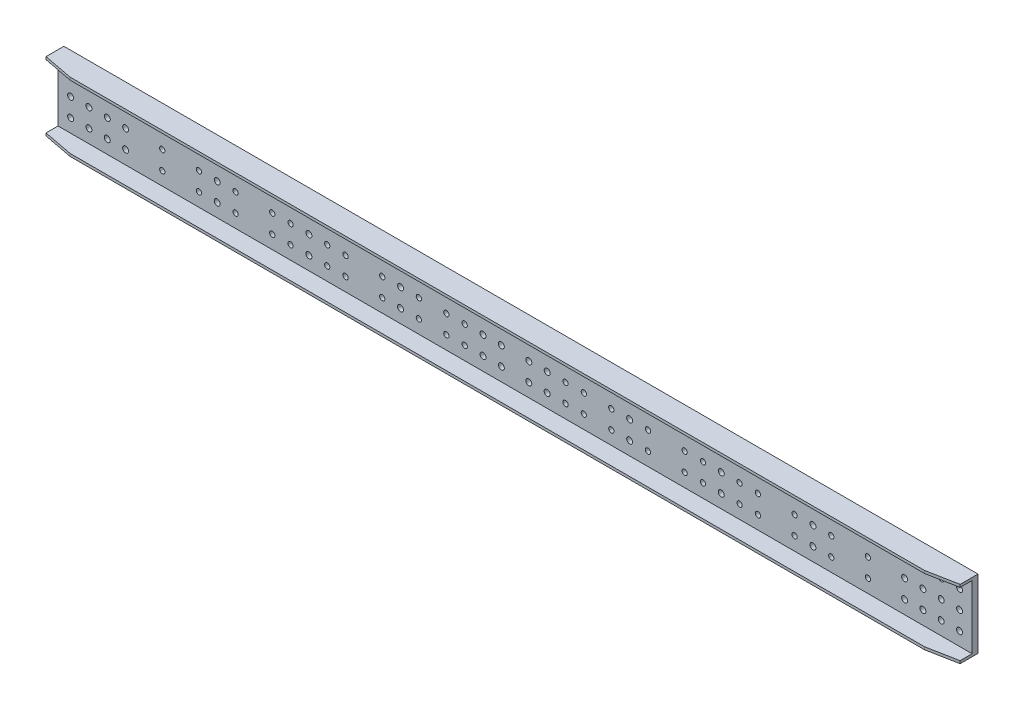
from build123d import *

# Parameters (mm, degrees)
SKETCH_1_W          = 3990
SKETCH_1_H          = 300
SKETCH_1_R          = 13
SKETCH_1_R_2        = 11.5
EXTRUDE_1595_DEPTH  = 25.5
SKETCH_2_W          = 3990
SKETCH_2_H          = 11.5
EXTRUDE_1_DEPTH     = 77.5
SKETCH_3_W          = 70
SKETCH_3_H          = 230
EXTRUDE_2_DEPTH     = 16
SKETCH_4_R          = 13
CUT_EXTRUDE_1_DEPTH = 2003.131676489
CUT_EXTRUDE_2_DEPTH = 2021.057919962


with BuildPart() as part:
    # 草图1 → Extrude 1595 (new body)
    with BuildSketch(Plane.XY):
        Rectangle(SKETCH_1_W, SKETCH_1_H)
        with Locations((1940, 80)):
            Circle(SKETCH_1_R, mode=Mode.SUBTRACT)
        with Locations((1860, 80)):
            Circle(SKETCH_1_R, mode=Mode.SUBTRACT)
        with Locations((1780, 80)):
            Circle(SKETCH_1_R, mode=Mode.SUBTRACT)
        with Locations((1700, 80)):
            Circle(SKETCH_1_R, mode=Mode.SUBTRACT)
        with Locations((1540, 80)):
            Circle(SKETCH_1_R_2, mode=Mode.SUBTRACT)
        with Locations((1380, 80)):
            Circle(SKETCH_1_R_2, mode=Mode.SUBTRACT)
        with Locations((1220, 80)):
            Circle(SKETCH_1_R_2, mode=Mode.SUBTRACT)
        with Locations((1060, 80)):
            Circle(SKETCH_1_R_2, mode=Mode.SUBTRACT)
        with Locations((980, 80)):
            Circle(SKETCH_1_R_2, mode=Mode.SUBTRACT)
        with Locations((820, 80)):
            Circle(SKETCH_1_R_2, mode=Mode.SUBTRACT)
        with Locations((740, 80)):
            Circle(SKETCH_1_R_2, mode=Mode.SUBTRACT)
        with Locations((580, 80)):
            Circle(SKETCH_1_R_2, mode=Mode.SUBTRACT)
        with Locations((980, 0)):
            Circle(SKETCH_1_R_2, mode=Mode.SUBTRACT)
        with Locations((1060, 0)):
            Circle(SKETCH_1_R_2, mode=Mode.SUBTRACT)
        with Locations((820, 0)):
            Circle(SKETCH_1_R_2, mode=Mode.SUBTRACT)
        with Locations((740, 0)):
            Circle(SKETCH_1_R_2, mode=Mode.SUBTRACT)
        with Locations((580, 0)):
            Circle(SKETCH_1_R_2, mode=Mode.SUBTRACT)
        with Locations((1220, 0)):
            Circle(SKETCH_1_R_2, mode=Mode.SUBTRACT)
        with Locations((1380, 0)):
            Circle(SKETCH_1_R_2, mode=Mode.SUBTRACT)
        with Locations((1540, 0)):
            Circle(SKETCH_1_R_2, mode=Mode.SUBTRACT)
        with Locations((1700, 0)):
            Circle(SKETCH_1_R, mode=Mode.SUBTRACT)
        with Locations((1780, 0)):
            Circle(SKETCH_1_R, mode=Mode.SUBTRACT)
        with Locations((1860, 0)):
            Circle(SKETCH_1_R, mode=Mode.SUBTRACT)
        with Locations((1940, 0)):
            Circle(SKETCH_1_R, mode=Mode.SUBTRACT)
        with Locations((420, 80)):
            Circle(SKETCH_1_R_2, mode=Mode.SUBTRACT)
        with Locations((420, 0)):
            Circle(SKETCH_1_R_2, mode=Mode.SUBTRACT)
        with Locations((300, 0)):
            Circle(SKETCH_1_R_2, mode=Mode.SUBTRACT)
        with Locations((300, 80)):
            Circle(SKETCH_1_R_2, mode=Mode.SUBTRACT)
        with Locations((220, 80)):
            Circle(SKETCH_1_R_2, mode=Mode.SUBTRACT)
        with Locations((220, 0)):
            Circle(SKETCH_1_R_2, mode=Mode.SUBTRACT)
        with Locations((140, 0)):
            Circle(SKETCH_1_R, mode=Mode.SUBTRACT)
        with Locations((140, 80)):
            Circle(SKETCH_1_R, mode=Mode.SUBTRACT)
        with Locations((60, 80)):
            Circle(SKETCH_1_R, mode=Mode.SUBTRACT)
        with Locations((60, 0)):
            Circle(SKETCH_1_R, mode=Mode.SUBTRACT)
        with Locations(Location((1700, -80, 0), (0, 0, 180))):
            Circle(SKETCH_1_R, mode=Mode.SUBTRACT)
        with Locations(Location((1780, -80, 0), (0, 0, 180))):
            Circle(SKETCH_1_R, mode=Mode.SUBTRACT)
        with Locations(Location((1860, -80, 0), (0, 0, 180))):
            Circle(SKETCH_1_R, mode=Mode.SUBTRACT)
        with Locations(Location((1940, -80, 0), (0, 0, 180))):
            Circle(SKETCH_1_R, mode=Mode.SUBTRACT)
        with Locations(Location((580, -80, 0), (0, 0, 180))):
            Circle(SKETCH_1_R_2, mode=Mode.SUBTRACT)
        with Locations(Location((740, -80, 0), (0, 0, 180))):
            Circle(SKETCH_1_R_2, mode=Mode.SUBTRACT)
        with Locations(Location((820, -80, 0), (0, 0, 180))):
            Circle(SKETCH_1_R_2, mode=Mode.SUBTRACT)
        with Locations(Location((980, -80, 0), (0, 0, 180))):
            Circle(SKETCH_1_R_2, mode=Mode.SUBTRACT)
        with Locations(Location((1060, -80, 0), (0, 0, 180))):
            Circle(SKETCH_1_R_2, mode=Mode.SUBTRACT)
        with Locations(Location((1220, -80, 0), (0, 0, 180))):
            Circle(SKETCH_1_R_2, mode=Mode.SUBTRACT)
        with Locations(Location((1380, -80, 0), (0, 0, 180))):
            Circle(SKETCH_1_R_2, mode=Mode.SUBTRACT)
        with Locations(Location((1540, -80, 0), (0, 0, 180))):
            Circle(SKETCH_1_R_2, mode=Mode.SUBTRACT)
        with Locations(Location((220, -80, 0), (0, 0, 180))):
            Circle(SKETCH_1_R_2, mode=Mode.SUBTRACT)
        with Locations(Location((300, -80, 0), (0, 0, 180))):
            Circle(SKETCH_1_R_2, mode=Mode.SUBTRACT)
        with Locations(Location((420, -80, 0), (0, 0, 180))):
            Circle(SKETCH_1_R_2, mode=Mode.SUBTRACT)
        with Locations(Location((60, -80, 0), (0, 0, 180))):
            Circle(SKETCH_1_R, mode=Mode.SUBTRACT)
        with Locations(Location((140, -80, 0), (0, 0, 180))):
            Circle(SKETCH_1_R, mode=Mode.SUBTRACT)
        with Locations((-140, -80)):
            Circle(SKETCH_1_R, mode=Mode.SUBTRACT)
        with Locations((-60, -80)):
            Circle(SKETCH_1_R, mode=Mode.SUBTRACT)
        with Locations((-580, -80)):
            Circle(SKETCH_1_R_2, mode=Mode.SUBTRACT)
        with Locations((-420, -80)):
            Circle(SKETCH_1_R_2, mode=Mode.SUBTRACT)
        with Locations((-300, -80)):
            Circle(SKETCH_1_R_2, mode=Mode.SUBTRACT)
        with Locations((-220, -80)):
            Circle(SKETCH_1_R_2, mode=Mode.SUBTRACT)
        with Locations((-1540, -80)):
            Circle(SKETCH_1_R_2, mode=Mode.SUBTRACT)
        with Locations((-1380, -80)):
            Circle(SKETCH_1_R_2, mode=Mode.SUBTRACT)
        with Locations((-1220, -80)):
            Circle(SKETCH_1_R_2, mode=Mode.SUBTRACT)
        with Locations((-1060, -80)):
            Circle(SKETCH_1_R_2, mode=Mode.SUBTRACT)
        with Locations((-980, -80)):
            Circle(SKETCH_1_R_2, mode=Mode.SUBTRACT)
        with Locations((-820, -80)):
            Circle(SKETCH_1_R_2, mode=Mode.SUBTRACT)
        with Locations((-740, -80)):
            Circle(SKETCH_1_R_2, mode=Mode.SUBTRACT)
        with Locations((-1940, -80)):
            Circle(SKETCH_1_R, mode=Mode.SUBTRACT)
        with Locations((-1860, -80)):
            Circle(SKETCH_1_R, mode=Mode.SUBTRACT)
        with Locations((-1780, -80)):
            Circle(SKETCH_1_R, mode=Mode.SUBTRACT)
        with Locations((-1700, -80)):
            Circle(SKETCH_1_R, mode=Mode.SUBTRACT)
        with Locations(Location((-60, 0, 0), (0, 0, 180))):
            Circle(SKETCH_1_R, mode=Mode.SUBTRACT)
        with Locations(Location((-60, 80, 0), (0, 0, 180))):
            Circle(SKETCH_1_R, mode=Mode.SUBTRACT)
        with Locations(Location((-140, 80, 0), (0, 0, 180))):
            Circle(SKETCH_1_R, mode=Mode.SUBTRACT)
        with Locations(Location((-140, 0, 0), (0, 0, 180))):
            Circle(SKETCH_1_R, mode=Mode.SUBTRACT)
        with Locations(Location((-220, 0, 0), (0, 0, 180))):
            Circle(SKETCH_1_R_2, mode=Mode.SUBTRACT)
        with Locations(Location((-220, 80, 0), (0, 0, 180))):
            Circle(SKETCH_1_R_2, mode=Mode.SUBTRACT)
        with Locations(Location((-300, 80, 0), (0, 0, 180))):
            Circle(SKETCH_1_R_2, mode=Mode.SUBTRACT)
        with Locations(Location((-300, 0, 0), (0, 0, 180))):
            Circle(SKETCH_1_R_2, mode=Mode.SUBTRACT)
        with Locations(Location((-420, 0, 0), (0, 0, 180))):
            Circle(SKETCH_1_R_2, mode=Mode.SUBTRACT)
        with Locations(Location((-420, 80, 0), (0, 0, 180))):
            Circle(SKETCH_1_R_2, mode=Mode.SUBTRACT)
        with Locations(Location((-1940, 0, 0), (0, 0, 180))):
            Circle(SKETCH_1_R, mode=Mode.SUBTRACT)
        with Locations(Location((-1860, 0, 0), (0, 0, 180))):
            Circle(SKETCH_1_R, mode=Mode.SUBTRACT)
        with Locations(Location((-1780, 0, 0), (0, 0, 180))):
            Circle(SKETCH_1_R, mode=Mode.SUBTRACT)
        with Locations(Location((-1700, 0, 0), (0, 0, 180))):
            Circle(SKETCH_1_R, mode=Mode.SUBTRACT)
        with Locations(Location((-1540, 0, 0), (0, 0, 180))):
            Circle(SKETCH_1_R_2, mode=Mode.SUBTRACT)
        with Locations(Location((-1380, 0, 0), (0, 0, 180))):
            Circle(SKETCH_1_R_2, mode=Mode.SUBTRACT)
        with Locations(Location((-1220, 0, 0), (0, 0, 180))):
            Circle(SKETCH_1_R_2, mode=Mode.SUBTRACT)
        with Locations(Location((-580, 0, 0), (0, 0, 180))):
            Circle(SKETCH_1_R_2, mode=Mode.SUBTRACT)
        with Locations(Location((-740, 0, 0), (0, 0, 180))):
            Circle(SKETCH_1_R_2, mode=Mode.SUBTRACT)
        with Locations(Location((-820, 0, 0), (0, 0, 180))):
            Circle(SKETCH_1_R_2, mode=Mode.SUBTRACT)
        with Locations(Location((-1060, 0, 0), (0, 0, 180))):
            Circle(SKETCH_1_R_2, mode=Mode.SUBTRACT)
        with Locations(Location((-980, 0, 0), (0, 0, 180))):
            Circle(SKETCH_1_R_2, mode=Mode.SUBTRACT)
        with Locations(Location((-580, 80, 0), (0, 0, 180))):
            Circle(SKETCH_1_R_2, mode=Mode.SUBTRACT)
        with Locations(Location((-740, 80, 0), (0, 0, 180))):
            Circle(SKETCH_1_R_2, mode=Mode.SUBTRACT)
        with Locations(Location((-820, 80, 0), (0, 0, 180))):
            Circle(SKETCH_1_R_2, mode=Mode.SUBTRACT)
        with Locations(Location((-980, 80, 0), (0, 0, 180))):
            Circle(SKETCH_1_R_2, mode=Mode.SUBTRACT)
        with Locations(Location((-1060, 80, 0), (0, 0, 180))):
            Circle(SKETCH_1_R_2, mode=Mode.SUBTRACT)
        with Locations(Location((-1220, 80, 0), (0, 0, 180))):
            Circle(SKETCH_1_R_2, mode=Mode.SUBTRACT)
        with Locations(Location((-1380, 80, 0), (0, 0, 180))):
            Circle(SKETCH_1_R_2, mode=Mode.SUBTRACT)
        with Locations(Location((-1540, 80, 0), (0, 0, 180))):
            Circle(SKETCH_1_R_2, mode=Mode.SUBTRACT)
        with Locations(Location((-1700, 80, 0), (0, 0, 180))):
            Circle(SKETCH_1_R, mode=Mode.SUBTRACT)
        with Locations(Location((-1780, 80, 0), (0, 0, 180))):
            Circle(SKETCH_1_R, mode=Mode.SUBTRACT)
        with Locations(Location((-1860, 80, 0), (0, 0, 180))):
            Circle(SKETCH_1_R, mode=Mode.SUBTRACT)
        with Locations(Location((-1940, 80, 0), (0, 0, 180))):
            Circle(SKETCH_1_R, mode=Mode.SUBTRACT)
    extrude(amount=EXTRUDE_1595_DEPTH)

    # 草图2 → 凸台-拉伸1 (add)
    with BuildSketch(Plane.XY.offset(25.5)):
        with Locations((0, 144.25)):
            Rectangle(SKETCH_2_W, SKETCH_2_H)
        with Locations((0, -144.25)):
            Rectangle(SKETCH_2_W, SKETCH_2_H)
    extrude(amount=EXTRUDE_1_DEPTH)

    # 草图3 → 凸台-拉伸2 (add)
    with BuildSketch(Plane(origin=(0, 0, 0), x_dir=(-1, 0, 0), z_dir=(0, 0, -1))):
        with Locations((1300, 0)):
            Rectangle(SKETCH_3_W, SKETCH_3_H)
        with Locations((900, 0)):
            Rectangle(SKETCH_3_W, SKETCH_3_H)
        with Locations((-1300, 0)):
            Rectangle(SKETCH_3_W, SKETCH_3_H)
        with Locations((500, 0)):
            Rectangle(SKETCH_3_W, SKETCH_3_H)
        with Locations((-900, 0)):
            Rectangle(SKETCH_3_W, SKETCH_3_H)
        with Locations((-500, 0)):
            Rectangle(SKETCH_3_W, SKETCH_3_H)
    extrude(amount=EXTRUDE_2_DEPTH)

    # 草图4 → 切除-拉伸1 (cut, through all)
    with BuildSketch(Plane.XY.offset(25.5)):
        with Locations((1300, 80)):
            Circle(SKETCH_4_R)
        with Locations((900, 80)):
            Circle(SKETCH_4_R)
        with Locations((900, 0)):
            Circle(SKETCH_4_R)
        with Locations((1300, 0)):
            Circle(SKETCH_4_R)
        with Locations((900, -80)):
            Circle(SKETCH_4_R)
        with Locations((1300, -80)):
            Circle(SKETCH_4_R)
        with Locations((500, 80)):
            Circle(SKETCH_4_R)
        with Locations((500, 0)):
            Circle(SKETCH_4_R)
        with Locations((500, -80)):
            Circle(SKETCH_4_R)
        with Locations((-500, -80)):
            Circle(SKETCH_4_R)
        with Locations((-500, 0)):
            Circle(SKETCH_4_R)
        with Locations((-500, 80)):
            Circle(SKETCH_4_R)
        with Locations((-1300, -80)):
            Circle(SKETCH_4_R)
        with Locations((-900, -80)):
            Circle(SKETCH_4_R)
        with Locations((-1300, 0)):
            Circle(SKETCH_4_R)
        with Locations((-900, 0)):
            Circle(SKETCH_4_R)
        with Locations((-900, 80)):
            Circle(SKETCH_4_R)
        with Locations((-1300, 80)):
            Circle(SKETCH_4_R)
    extrude(amount=-CUT_EXTRUDE_1_DEPTH, mode=Mode.SUBTRACT)

    # 草图5 → 切除-拉伸2 (cut, through all)
    with BuildSketch(Plane(origin=(0, 150, 0), x_dir=(-1, 0, 0), z_dir=(0, 1, 0))):
        Polygon((-1995, 78), (-1995, 103), (-1865, 103), align=None)
        Polygon((1865, 103), (1995, 78), (1995, 103), align=None)
    extrude(amount=-CUT_EXTRUDE_2_DEPTH, mode=Mode.SUBTRACT)


solid = part.part
